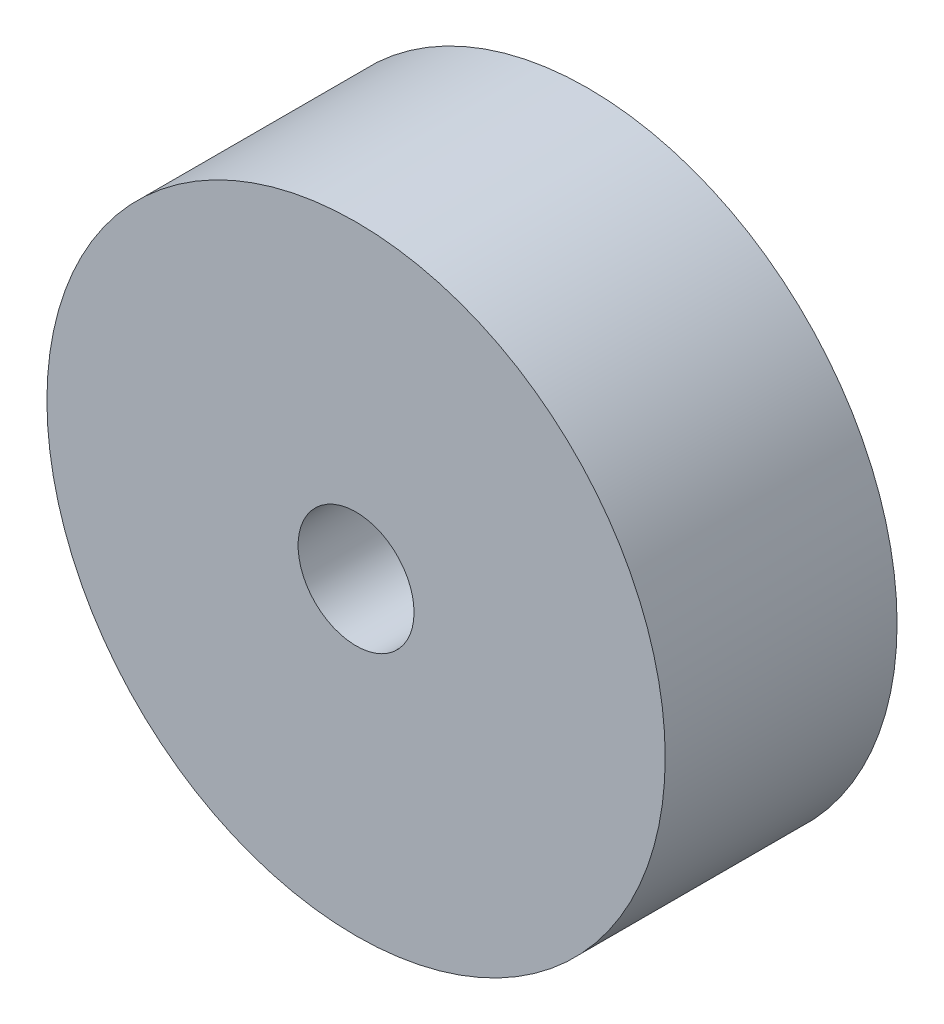
from build123d import *

# Parameters (mm, degrees)
SKETCH3_R           = 101.6
BOSS_EXTRUDE2_DEPTH = 76.2
SKETCH4_R           = 19.05
CUT_EXTRUDE2_DEPTH  = 76.2


with BuildPart() as part:
    # Sketch3 → Boss-Extrude2 (new body)
    with BuildSketch(Plane.XY):
        with Locations(Location((0, 0, 0), (0, 0, 180))):
            Circle(SKETCH3_R)
    extrude(amount=BOSS_EXTRUDE2_DEPTH)

    # Sketch4 → Cut-Extrude2 (cut)
    with BuildSketch(Plane.XY.offset(76.2)):
        Circle(SKETCH4_R)
    extrude(amount=-CUT_EXTRUDE2_DEPTH, mode=Mode.SUBTRACT)


solid = part.part
